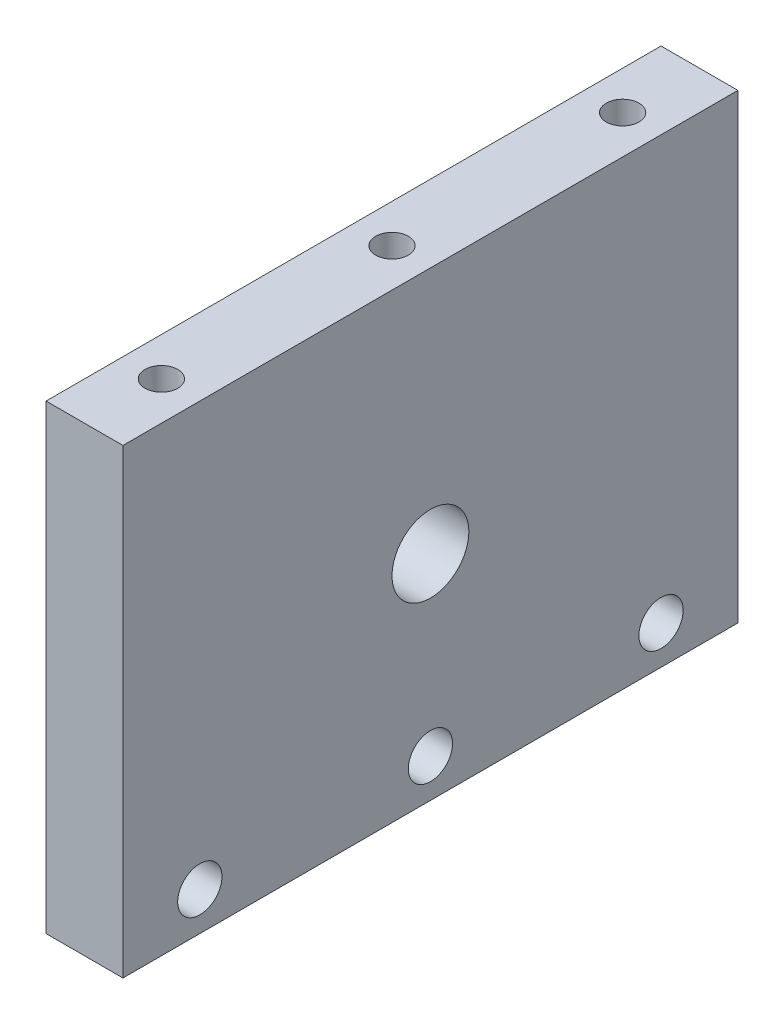
from build123d import *

# Parameters (mm, degrees)
SKETCH1_W                 = 50.8
SKETCH1_H                 = 38.1
BOSS_EXTRUDE1_DEPTH       = 6.35
SKETCH3_R                 = 1.8288
CUT_EXTRUDE1_DEPTH        = 6.35
F_6_32_TAPPED_HOLE1_D     = 2.7051
F_6_32_TAPPED_HOLE1_DEPTH = 11.88730597
F_6_32_TAPPED_HOLE1_TIP   = 0.81269403
SKETCH12_R                = 3.175
CUT_EXTRUDE3_DEPTH        = 6.35


with BuildPart() as part:
    # Sketch1 → Boss-Extrude1 (new body)
    with BuildSketch(Plane(origin=(0, 0, 0), x_dir=(0, 0, -1), z_dir=(1, 0, 0))):
        with Locations((-25.4, 19.05)):
            Rectangle(SKETCH1_W, SKETCH1_H)
    extrude(amount=BOSS_EXTRUDE1_DEPTH)

    # Sketch3 → Cut-Extrude1 (cut)
    with BuildSketch(Plane(origin=(6.35, 0, 0), x_dir=(0, 0, -1), z_dir=(1, 0, 0))):
        with Locations((-44.45, 3.175)):
            Circle(SKETCH3_R)
        with Locations((-25.4, 3.175)):
            Circle(SKETCH3_R)
        with Locations((-6.35, 3.175)):
            Circle(SKETCH3_R)
    extrude(amount=-CUT_EXTRUDE1_DEPTH, mode=Mode.SUBTRACT)

    # #6-32 Tapped Hole1
    with Locations(Plane(origin=(0, 38.1, 0), x_dir=(1, 0, 0), z_dir=(0, 1, 0))):
        with Locations((3.175, -6.35), (3.175, -25.4), (3.175, -44.45)):
            Hole(F_6_32_TAPPED_HOLE1_D / 2, depth=F_6_32_TAPPED_HOLE1_DEPTH)
            with Locations((0, 0, -(F_6_32_TAPPED_HOLE1_DEPTH + F_6_32_TAPPED_HOLE1_TIP / 2))):  # 118° drill point
                Cone(0, F_6_32_TAPPED_HOLE1_D / 2, F_6_32_TAPPED_HOLE1_TIP, mode=Mode.SUBTRACT)

    # Sketch12 → Cut-Extrude3 (cut)
    with BuildSketch(Plane(origin=(6.35, 0, 0), x_dir=(0, 0, -1), z_dir=(1, 0, 0))):
        with Locations((-25.4, 17.653)):
            Circle(SKETCH12_R)
    extrude(amount=-CUT_EXTRUDE3_DEPTH, mode=Mode.SUBTRACT)


solid = part.part
